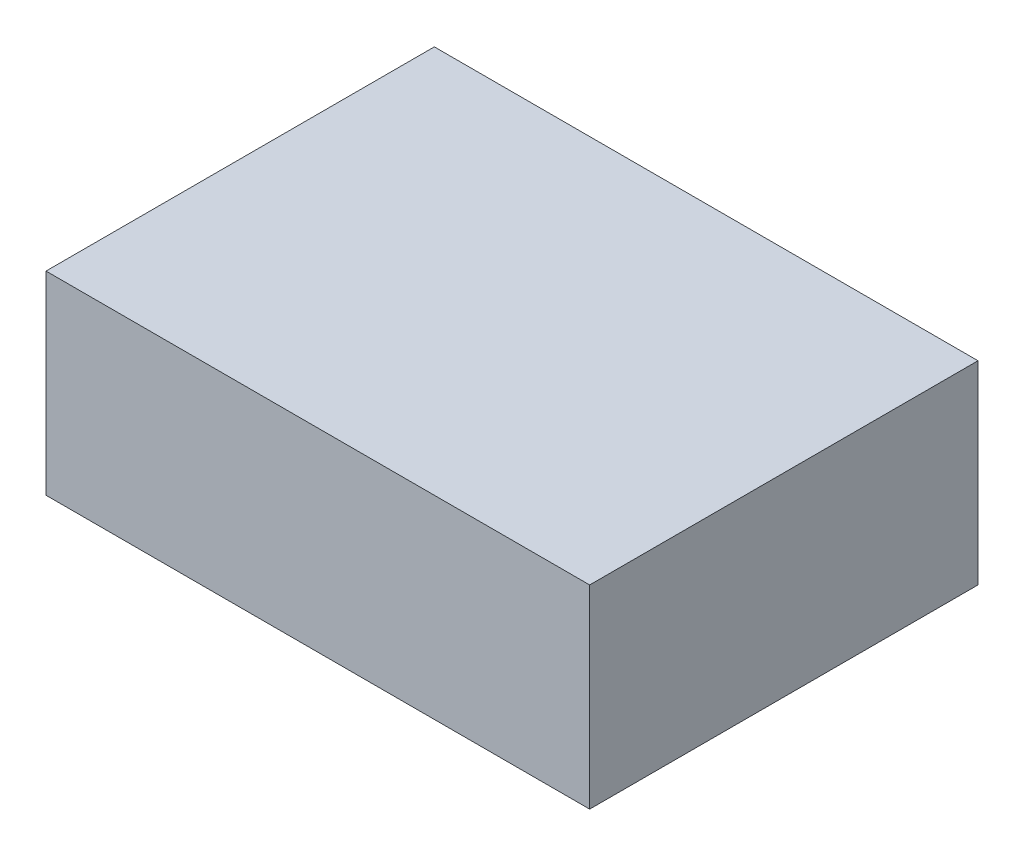
from build123d import *

# Parameters (mm, degrees)
SKETCH1_W           = 1.4
SKETCH1_H           = 1
BOSS_EXTRUDE1_DEPTH = 0.5


with BuildPart() as part:
    # Sketch1 → Boss-Extrude1 (new body)
    with BuildSketch(Plane(origin=(0, 0, 0), x_dir=(1, 0, 0), z_dir=(0, 1, 0))):
        Rectangle(SKETCH1_W, SKETCH1_H)
    extrude(amount=BOSS_EXTRUDE1_DEPTH)


solid = part.part
